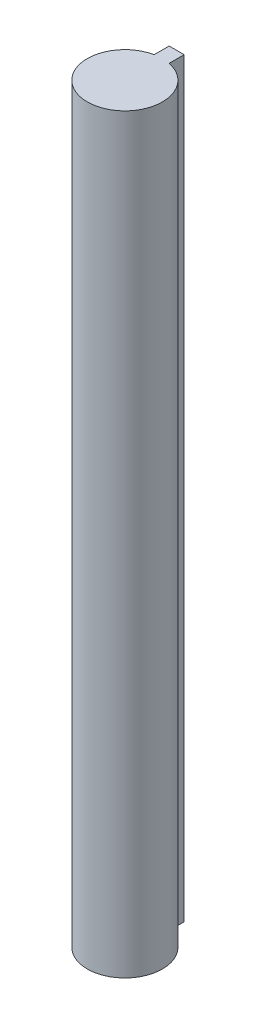
from build123d import *

# Parameters (mm, degrees)
EXTRUDE_1_DEPTH = 200


with BuildPart() as part:
    # 草图1 → 凸台-拉伸1 (new body)
    with BuildSketch(Plane(origin=(0, 0, 0), x_dir=(1, 0, 0), z_dir=(0, 1, 0))):
        with BuildLine():
            Line((-2, 9.797958971), (-2, 13.797958971))
            Line((-2, 13.797958971), (2, 13.797958971))
            Line((2, 13.797958971), (2, 9.797958971))
            ThreePointArc((2, 9.797958971), (0, -10), (-2, 9.797958971))
        make_face()
    extrude(amount=EXTRUDE_1_DEPTH)


solid = part.part
